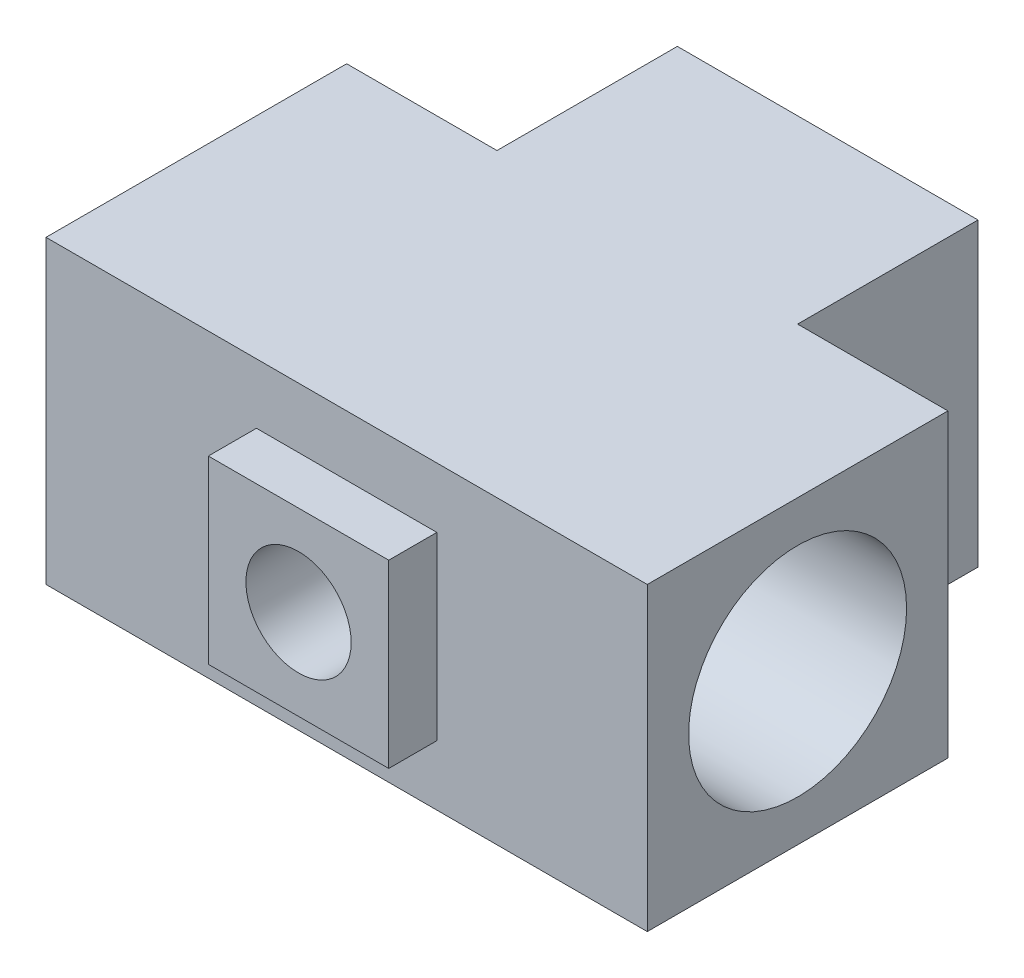
from build123d import *

# Parameters (mm, degrees)
SKETCH2_W                            = 63.5
SKETCH2_H                            = 31.75
SKETCH2_W_2                          = 31.75
SKETCH2_H_2                          = 19.05
BOSS_EXTRUDE1_DEPTH                  = 31.75
F_29_32_0_90625_DIAMETER_HOLE1_D     = 23.01875
F_29_32_0_90625_DIAMETER_HOLE2_D     = 23.01875
F_29_32_0_90625_DIAMETER_HOLE2_DEPTH = 34.29
F_29_32_0_90625_DIAMETER_HOLE2_TIP   = 6.915530187
BOSS_EXTRUDE2_DEPTH                  = 5.08
F_7_16_0_4375_DIAMETER_HOLE1_D       = 11.1125
F_7_16_0_4375_DIAMETER_HOLE1_DEPTH   = 25.4
F_7_16_0_4375_DIAMETER_HOLE1_TIP     = 3.338531814


with BuildPart() as part:
    # Sketch2 → Boss-Extrude1 (new body)
    with BuildSketch(Plane(origin=(0, 0, 0), x_dir=(1, 0, 0), z_dir=(0, 1, 0))):
        Rectangle(SKETCH2_W, SKETCH2_H)
        with Locations((0, 25.4)):
            Rectangle(SKETCH2_W_2, SKETCH2_H_2)
    extrude(amount=BOSS_EXTRUDE1_DEPTH)

    # 29/32 (0.90625) Diameter Hole1 (through all)
    with Locations(Plane(origin=(31.75, 0, 0), x_dir=(0, 0, -1), z_dir=(1, 0, 0))):
        with Locations((0, 15.875)):
            Hole(F_29_32_0_90625_DIAMETER_HOLE1_D / 2)

    # 29/32 (0.90625) Diameter Hole2
    with Locations(Plane(origin=(0, 0, -34.925), x_dir=(-1, 0, 0), z_dir=(0, 0, -1))):
        with Locations((0, 15.875)):
            Hole(F_29_32_0_90625_DIAMETER_HOLE2_D / 2, depth=F_29_32_0_90625_DIAMETER_HOLE2_DEPTH)
            with Locations((0, 0, -(F_29_32_0_90625_DIAMETER_HOLE2_DEPTH + F_29_32_0_90625_DIAMETER_HOLE2_TIP / 2))):  # 118° drill point
                Cone(0, F_29_32_0_90625_DIAMETER_HOLE2_D / 2, F_29_32_0_90625_DIAMETER_HOLE2_TIP, mode=Mode.SUBTRACT)

    # Sketch10 → Boss-Extrude2 (add)
    with BuildSketch(Plane.XY.offset(15.875)):
        Polygon((9.525, 11.1125), (-9.525, 20.6375), (-9.525, 6.35), (9.525, 6.35), align=None)
        Polygon((-9.525, 25.4), (-9.525, 20.6375), (9.525, 11.1125), (9.525, 25.4), align=None)
    extrude(amount=BOSS_EXTRUDE2_DEPTH)

    # 7/16 (0.4375) Diameter Hole1
    with Locations(Plane.XY.offset(20.955)):
        with Locations((0, 15.875)):
            Hole(F_7_16_0_4375_DIAMETER_HOLE1_D / 2, depth=F_7_16_0_4375_DIAMETER_HOLE1_DEPTH)
            with Locations((0, 0, -(F_7_16_0_4375_DIAMETER_HOLE1_DEPTH + F_7_16_0_4375_DIAMETER_HOLE1_TIP / 2))):  # 118° drill point
                Cone(0, F_7_16_0_4375_DIAMETER_HOLE1_D / 2, F_7_16_0_4375_DIAMETER_HOLE1_TIP, mode=Mode.SUBTRACT)


solid = part.part
